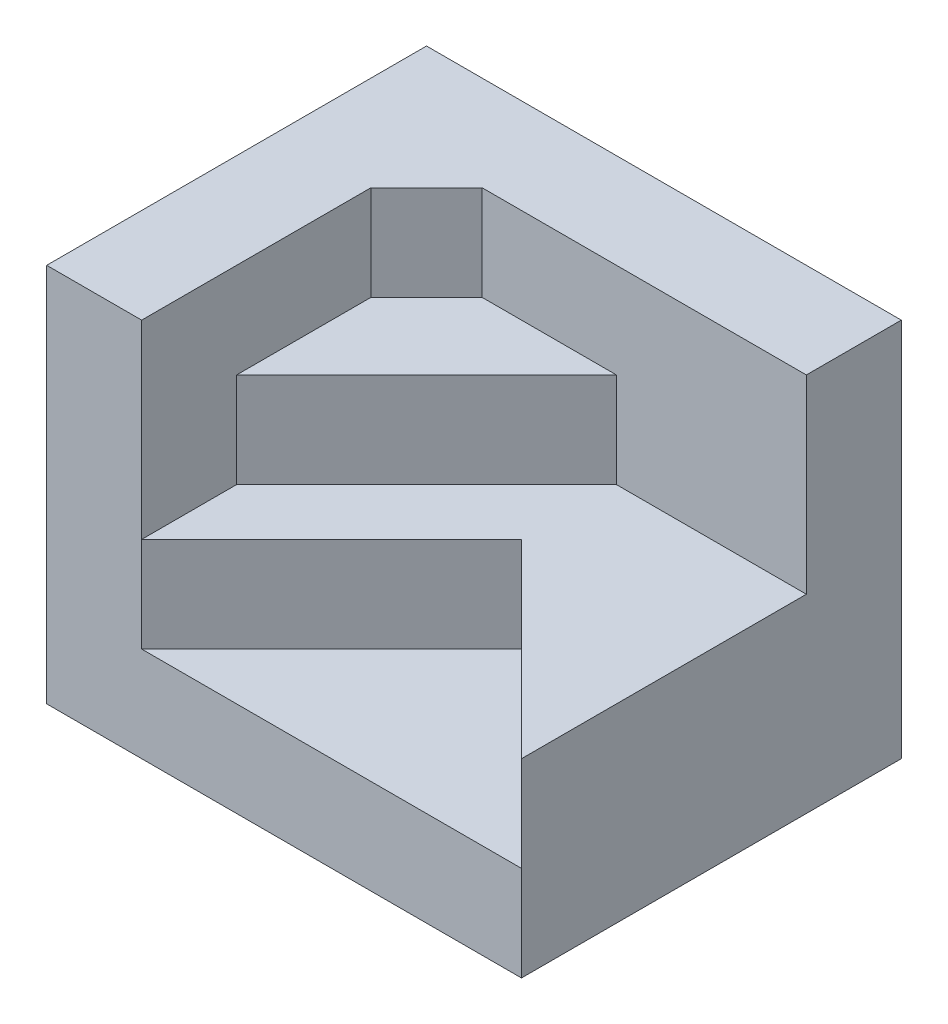
from build123d import *

# Parameters (mm, degrees)
SKETCH1_W           = 50
SKETCH1_H           = 40
BOSS_EXTRUDE1_DEPTH = 40
CUT_EXTRUDE1_DEPTH  = 10
CUT_EXTRUDE2_DEPTH  = 20
CUT_EXTRUDE3_DEPTH  = 10


with BuildPart() as part:
    # Sketch1 → Boss-Extrude1 (new body)
    with BuildSketch(Plane(origin=(0, 0, 0), x_dir=(1, 0, 0), z_dir=(0, 1, 0))):
        with Locations((-15, 0)):
            Rectangle(SKETCH1_W, SKETCH1_H)
    extrude(amount=BOSS_EXTRUDE1_DEPTH)

    # Sketch2 → Cut-Extrude1 (cut)
    with BuildSketch(Plane(origin=(0, 40, 0), x_dir=(1, 0, 0), z_dir=(0, 1, 0))):
        Polygon((-30, -10), (-30, 4.142135624), (-24.142135624, 10), (-10, 10), align=None)
    extrude(amount=-CUT_EXTRUDE1_DEPTH, mode=Mode.SUBTRACT)

    # Sketch3 → Cut-Extrude2 (cut)
    with BuildSketch(Plane(origin=(0, 40, 0), x_dir=(1, 0, 0), z_dir=(0, 1, 0))):
        Polygon((-30, -10), (-30, -20), (10, -20), (10, 10), (-10, 10), align=None)
    extrude(amount=-CUT_EXTRUDE2_DEPTH, mode=Mode.SUBTRACT)

    # Sketch4 → Cut-Extrude3 (cut)
    with BuildSketch(Plane(origin=(0, 20, 0), x_dir=(1, 0, 0), z_dir=(0, 1, 0))):
        Polygon((-30, -20), (-10, 0), (10, -20), align=None)
    extrude(amount=-CUT_EXTRUDE3_DEPTH, mode=Mode.SUBTRACT)


solid = part.part
